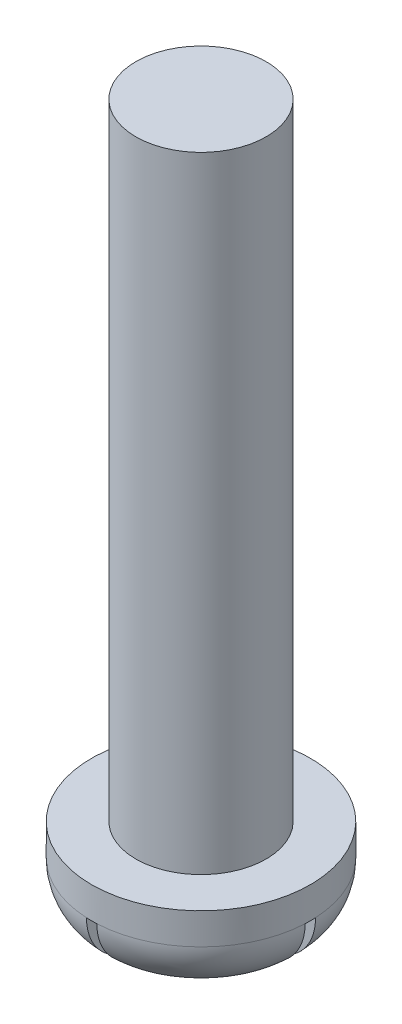
from build123d import *

# Parameters (mm, degrees)
SKETCH_1_R               = 2.1
EXTRUDE_1_DEPTH          = 1.6
SKETCH_2_R               = 1.25
EXTRUDE_2_DEPTH          = 12
CUT_EXTRUDE_1_DEPTH      = 14.920488497
CUT_EXTRUDE_1_DEPTH_BACK = 1
SKETCH_4_W               = 4.2
SKETCH_4_H               = 0.2
SKETCH_4_W_2             = 0.2
SKETCH_4_H_2             = 4.2
FILLET_1_R               = 1


with BuildPart() as part:
    # 草图1 → 凸台-拉伸1 (new body)
    with BuildSketch(Plane(origin=(0, 0, 0), x_dir=(1, 0, 0), z_dir=(0, 1, 0))):
        Circle(SKETCH_1_R)
    extrude(amount=-EXTRUDE_1_DEPTH)

    # 草图2 → 凸台-拉伸2 (add)
    with BuildSketch(Plane(origin=(0, 0, 0), x_dir=(1, 0, 0), z_dir=(0, 1, 0))):
        Circle(SKETCH_2_R)
    extrude(amount=EXTRUDE_2_DEPTH)

    # 草图4 → 切除-拉伸-薄壁1 (cut, two sides: drawn at the far end of the back side and taken through both)
    with BuildSketch(Plane.XZ.offset(1.6).offset(-CUT_EXTRUDE_1_DEPTH_BACK)):
        Rectangle(SKETCH_4_W, SKETCH_4_H)
        Rectangle(SKETCH_4_W_2, SKETCH_4_H_2)
    extrude(amount=CUT_EXTRUDE_1_DEPTH + CUT_EXTRUDE_1_DEPTH_BACK, mode=Mode.SUBTRACT)

    # 圆角1
    fillet_1_edges = [part.edges().sort_by_distance(p)[0] for p in [
        (1.48492424, -1.6, 1.48492424),
        (-1.48492424, -1.6, 1.48492424),
        (-1.48492424, -1.6, -1.48492424),
        (1.48492424, -1.6, -1.48492424),
    ]]
    fillet(fillet_1_edges, radius=FILLET_1_R)


solid = part.part
